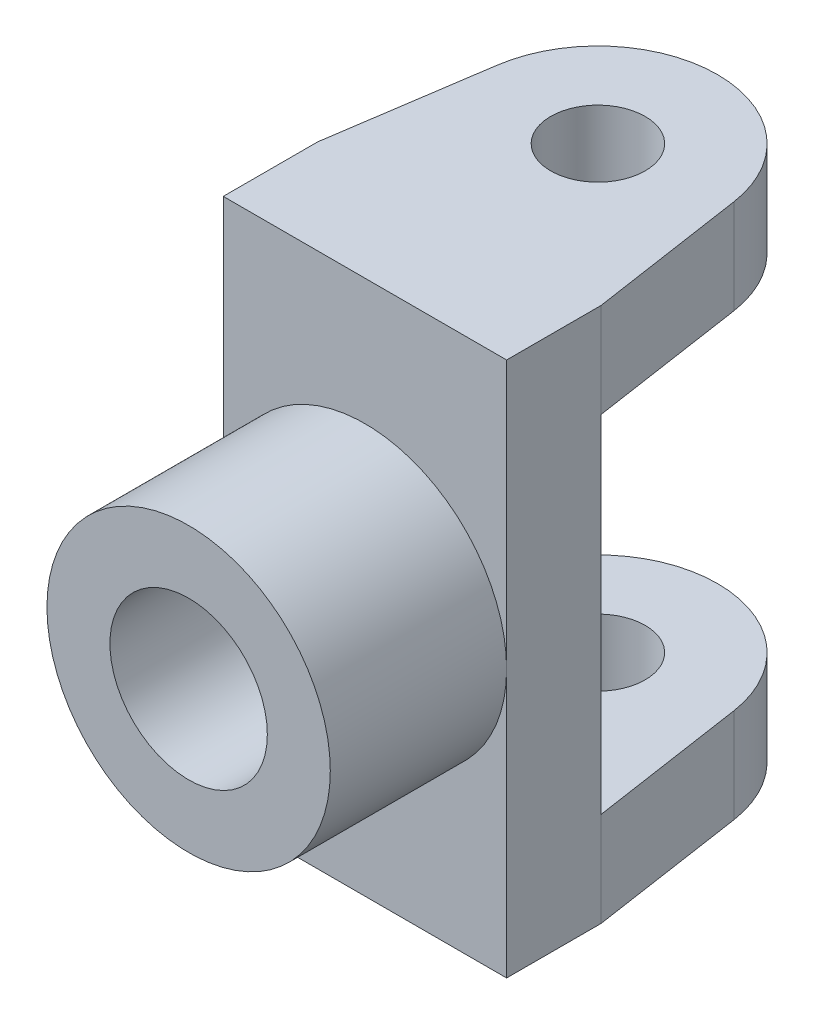
from build123d import *

# Parameters (mm, degrees)
SKETCH2_W           = 90
SKETCH2_H           = 170
BOSS_EXTRUDE1_DEPTH = 30
SKETCH3_R           = 45
SKETCH3_R_2         = 25
BOSS_EXTRUDE2_DEPTH = 56
SKETCH5_R           = 15
BOSS_EXTRUDE3_DEPTH = 30


with BuildPart() as part:
    # Sketch2 → Boss-Extrude1 (new body)
    with BuildSketch(Plane.XY):
        Rectangle(SKETCH2_W, SKETCH2_H)
    extrude(amount=-BOSS_EXTRUDE1_DEPTH)

    # Sketch3 → Boss-Extrude2 (add)
    with BuildSketch(Plane.XY):
        Circle(SKETCH3_R)
        Circle(SKETCH3_R_2, mode=Mode.SUBTRACT)
    extrude(amount=BOSS_EXTRUDE2_DEPTH)

    # Sketch5 → Boss-Extrude3 (add)
    with BuildSketch(Plane.XZ.offset(85)):
        with BuildLine():
            Line((45, -30), (37.582367692, -79.618330594))
            ThreePointArc((37.582367692, -79.618330594), (0, -112), (-37.582367692, -79.618330594))
            Line((-37.582367692, -79.618330594), (-45, -30))
            Line((-45, -30), (45, -30))
        make_face()
        with Locations(Location((0, -74, 0), (0, 0, 270))):
            Circle(SKETCH5_R, mode=Mode.SUBTRACT)
    boss_extrude3 = extrude(amount=-BOSS_EXTRUDE3_DEPTH)

    # Mirror1: Boss-Extrude3 across plane
    add(boss_extrude3.mirror(Plane.ZX))


solid = part.part
